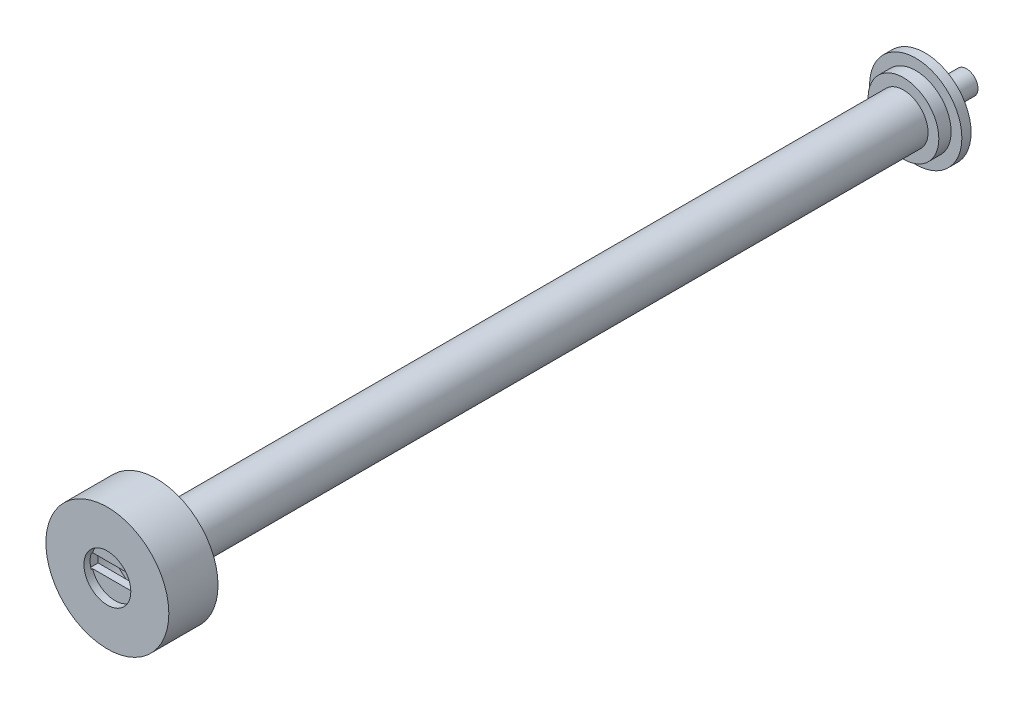
from build123d import *

# Parameters (mm, degrees)
SKETCH1_R                    = 1.5
SOCKET_PIN_DEPTH             = 5.5
SKETCH2_R                    = 6
MAST_FLANGE_DEPTH            = 1.2
SKETCH3_R                    = 4.6
MAST_FLANGE_STEP_DEPTH       = 1.6
SKETCH4_R                    = 3.2
MAST_TUBE_DEPTH              = 97.8
SKETCH5_R                    = 8
BEACON_BASE_DEPTH            = 6.4
SKETCH6_R                    = 5.5
SOLDER_CHAMBER_DEPTH         = 1.8
SKETCH7_W                    = 6.4
SKETCH7_H                    = 1.8
LED_LEG_SLOT_DEPTH           = 0.7
SKETCH8_R                    = 3.05
LED_FLANGE_COUNTERBORE_DEPTH = 0.7
SKETCH9_R                    = 1.1
WIRE_CHANNEL_DEPTH           = 49
SKETCH10_R                   = 1.1
WIRE_EXIT_DEPTH              = 2.25


with BuildPart() as part:
    # Sketch1 → Socket_pin (new body)
    with BuildSketch(Plane.XY.offset(54.6)):
        with Locations((172, 45)):
            Circle(SKETCH1_R)
    extrude(amount=SOCKET_PIN_DEPTH)

    # Sketch2 → Mast_flange (add)
    with BuildSketch(Plane.XY.offset(60)):
        with Locations((172, 45)):
            Circle(SKETCH2_R)
    extrude(amount=MAST_FLANGE_DEPTH)

    # Sketch3 → Mast_flange_step (add)
    with BuildSketch(Plane.XY.offset(61.2)):
        with Locations((172, 45)):
            Circle(SKETCH3_R)
    extrude(amount=MAST_FLANGE_STEP_DEPTH)

    # Sketch4 → Mast_tube (add)
    with BuildSketch(Plane.XY.offset(62.7)):
        with Locations((172, 45)):
            Circle(SKETCH4_R)
    extrude(amount=MAST_TUBE_DEPTH)

    # Sketch5 → Beacon_base (add)
    with BuildSketch(Plane.XY.offset(160)):
        with Locations((172, 45)):
            Circle(SKETCH5_R)
    extrude(amount=BEACON_BASE_DEPTH)

    # Sketch6 → Solder_chamber (cut, symmetric)
    with BuildSketch(Plane.XY.offset(162.6)):
        with Locations((172, 45)):
            Circle(SKETCH6_R)
    extrude(amount=SOLDER_CHAMBER_DEPTH, both=True, mode=Mode.SUBTRACT)

    # Sketch7 → LED_leg_slot (cut, symmetric)
    with BuildSketch(Plane.XY.offset(164.9)):
        with Locations((172, 45)):
            Rectangle(SKETCH7_W, SKETCH7_H)
    extrude(amount=LED_LEG_SLOT_DEPTH, both=True, mode=Mode.SUBTRACT)

    # Sketch8 → LED_flange_counterbore (cut, symmetric)
    with BuildSketch(Plane.XY.offset(166.1)):
        with Locations((172, 45)):
            Circle(SKETCH8_R)
    extrude(amount=LED_FLANGE_COUNTERBORE_DEPTH, both=True, mode=Mode.SUBTRACT)

    # Sketch9 → Wire_channel (cut, symmetric)
    with BuildSketch(Plane.XY.offset(112)):
        with Locations((172, 45)):
            Circle(SKETCH9_R)
    extrude(amount=WIRE_CHANNEL_DEPTH, both=True, mode=Mode.SUBTRACT)

    # Sketch10 → Wire_exit (cut, symmetric)
    with BuildSketch(Plane(origin=(0, 42.75, 0), x_dir=(1, 0, 0), z_dir=(0, 1, 0))):
        with Locations(Location((172, -65, 0), (0, 0, 270))):
            Circle(SKETCH10_R)
    extrude(amount=WIRE_EXIT_DEPTH, both=True, mode=Mode.SUBTRACT)


solid = part.part
